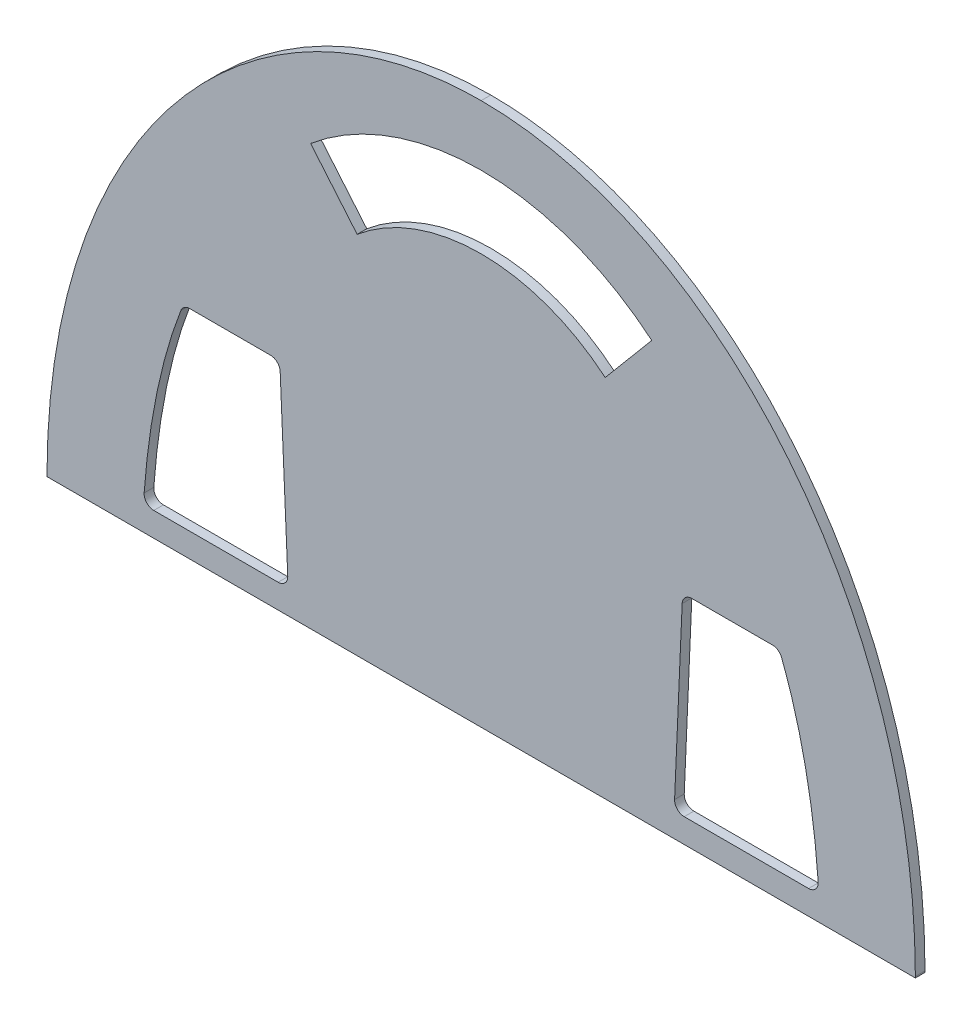
from build123d import *

# Parameters (mm, degrees)
BOSS_EXTRUDE1_DEPTH = 2
CUT_EXTRUDE1_DEPTH  = 145.084446485
FILLET1_R           = 2


with BuildPart() as part:
    # Sketch2 → Boss-Extrude1 (new body)
    with BuildSketch(Plane.XY):
        with BuildLine():
            Line((-90.000046343, 0), (90.000046343, 0))
            Line((90.000046343, 0), (90, 0.275147388))
            add(Edge.make_bspline(
                [(90, 0.275147388), (89.882695791, 65.723055247), (47.919981831, 112.50030816), (0, 112.50030816)],
                knots=[0.001398837, 0.001398837, 0.001398837, 0.001398837, 1, 1, 1, 1], degree=3))
            add(Edge.make_bspline(
                [(0, 112.50030816), (-47.919981831, 112.50030816), (-89.882695791, 65.723055247), (-90, 0.275147388)],
                knots=[0.001398837, 0.001398837, 0.001398837, 0.001398837, 1, 1, 1, 1], degree=3))
            Line((-90, 0.275147388), (-90.000046343, 0))
        make_face()
    extrude(amount=BOSS_EXTRUDE1_DEPTH)

    # Sketch3 → Cut-Extrude1 (cut, through all)
    with BuildSketch(Plane.XY.offset(2)):
        with BuildLine():
            Line((-70, 5), (-40, 5))
            Line((-40, 5), (-41.744775495, 44.961928863))
            Line((-41.744775495, 44.961928863), (-61.744775495, 44.961928863))
            add(Edge.make_bspline(
                [(-61.744775495, 44.961928863), (-68.623255679, 28.115773146), (-70, 5)],
                knots=[0.806321276, 0.806321276, 0.806321276, 1.431812181, 1.431812181, 1.431812181], degree=2, weights=[1, 0.951492458, 1]))
        make_face()
        with BuildLine():
            Line((40, 5), (41.744775495, 44.961928863))
            Line((41.744775495, 44.961928863), (61.744775495, 44.961928863))
            add(Edge.make_bspline(
                [(70, 5), (68.623255679, 28.115773146), (61.744775495, 44.961928863)],
                knots=[4.851373127, 4.851373127, 4.851373127, 5.476864031, 5.476864031, 5.476864031], degree=2, weights=[1, 0.951492458, 1]))
            Line((70, 5), (40, 5))
        make_face()
        with BuildLine():
            Line((-35.353318533, 87.132444372), (-25.711504387, 75.641777725))
            ThreePointArc((-25.711504387, 75.641777725), (0, 85), (25.711504387, 75.641777725))
            Line((25.711504387, 75.641777725), (35.353318533, 87.132444372))
            ThreePointArc((35.353318533, 87.132444372), (0, 100), (-35.353318533, 87.132444372))
        make_face()
    extrude(amount=-CUT_EXTRUDE1_DEPTH, mode=Mode.SUBTRACT)

    # Fillet1
    fillet1_edges = [part.edges().sort_by_distance(p)[0] for p in [
        (70, 5, 1),
        (61.744775495, 44.961928863, 1),
        (41.744775495, 44.961928863, 1),
        (40, 5, 1),
        (-61.744775495, 44.961928863, 1),
        (-41.744775495, 44.961928863, 1),
        (-40, 5, 1),
        (-70, 5, 1),
    ]]
    fillet(fillet1_edges, radius=FILLET1_R)


solid = part.part
